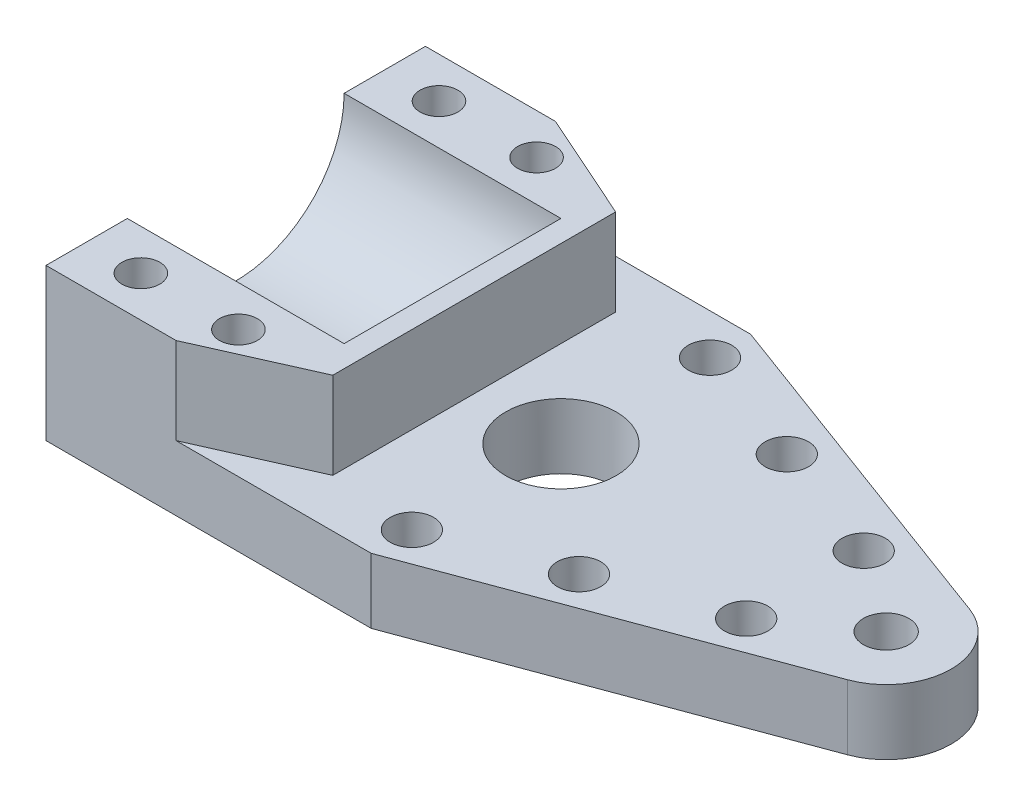
from build123d import *
from OCP.BRepFilletAPI import BRepFilletAPI_MakeChamfer

# Parameters (mm, degrees)
BOSS_EXTRUDE1_DEPTH      = 14
BOSS_EXTRUDE1_DEPTH_BACK = 14
SKETCH1_R                = 5.1
SKETCH1_R_2              = 2.1
SKETCH2_R                = 10
CUT_EXTRUDE1_DEPTH       = 20
CUT_EXTRUDE2_DEPTH       = 98
SKETCH4_R                = 2
SKETCH4_R_2              = 1.75
CUT_EXTRUDE3_DEPTH       = 98
CUT_EXTRUDE4_DEPTH       = 8
CHAMFER2_SIZE            = 10
CHAMFER2_SIZE2           = 4.452286853
SKETCH6_R                = 3.25
CUT_EXTRUDE5_DEPTH       = 1.5
SKETCH7_R                = 4.25
CUT_EXTRUDE6_DEPTH       = 1.5


with BuildPart() as part:
    # Sketch1 → Boss-Extrude1 (new, two sides: drawn at the far end of the back side and taken through both)
    with BuildSketch(Plane(origin=(0, 0, 0), x_dir=(1, 0, 0), z_dir=(0, 1, 0)).offset(-BOSS_EXTRUDE1_DEPTH_BACK)):
        with BuildLine():
            Line((-30, 17.5), (-30, -17.5))
            Line((-30, -17.5), (0, -17.5))
            Line((0, -17.5), (32.082434223, -5.627030097))
            ThreePointArc((32.082434223, -5.627030097), (36, 0), (32.082434223, 5.627030097))
            Line((32.082434223, 5.627030097), (0, 17.5))
            Line((0, 17.5), (-30, 17.5))
        make_face()
        Circle(SKETCH1_R, mode=Mode.SUBTRACT)
        with Locations((30, 0)):
            Circle(SKETCH1_R_2, mode=Mode.SUBTRACT)
    extrude(amount=BOSS_EXTRUDE1_DEPTH + BOSS_EXTRUDE1_DEPTH_BACK)

    # Sketch2 → Cut-Extrude1 (cut)
    with BuildSketch(Plane.ZY.offset(30)):
        Circle(SKETCH2_R)
    extrude(amount=-CUT_EXTRUDE1_DEPTH, mode=Mode.SUBTRACT)

    # Sketch3 → Cut-Extrude2 (cut)
    with BuildSketch(Plane.ZY.offset(30)):
        Polygon((-28.780571792, 0), (30.767977005, 0), (25.762660172, 25.983482973), (-26.204305774, 26.645951377), align=None)
    extrude(amount=-CUT_EXTRUDE2_DEPTH, mode=Mode.SUBTRACT)

    # Sketch4 → Cut-Extrude3 (cut)
    with BuildSketch(Plane(origin=(0, 0, 0), x_dir=(1, 0, 0), z_dir=(0, 1, 0))):
        with Locations((0, 13.75)):
            Circle(SKETCH4_R)
        with Locations((-25, 13.75)):
            Circle(SKETCH4_R_2)
        with Locations((-16, 13.75)):
            Circle(SKETCH4_R_2)
        with Locations((-16, -13.75)):
            Circle(SKETCH4_R_2)
        with Locations((-25, -13.75)):
            Circle(SKETCH4_R_2)
        with Locations((11.254060193, 9.585131554)):
            Circle(SKETCH4_R)
        with Locations((22.508120386, 5.420263108)):
            Circle(SKETCH4_R)
        with Locations((22.508120386, -5.420263108)):
            Circle(SKETCH4_R)
        with Locations((11.254060193, -9.585131554)):
            Circle(SKETCH4_R)
        with Locations((0, -13.75)):
            Circle(SKETCH4_R)
    extrude(amount=-CUT_EXTRUDE3_DEPTH, mode=Mode.SUBTRACT)

    # Sketch5 → Cut-Extrude4 (cut)
    with BuildSketch(Plane(origin=(0, 0, 0), x_dir=(1, 0, 0), z_dir=(0, 1, 0))):
        Polygon((-8, 24.0496753), (-8, -23.963165676), (49.955299995, -27.912565933), (56.964446833, 12.889933884), align=None)
    extrude(amount=-CUT_EXTRUDE4_DEPTH, mode=Mode.SUBTRACT)

    # Chamfer2: one chamfer whose edges measure the first distance from different faces: ONE call of the kernel's chamfer builder (chamfer() names one face for all edges)
    chamfer2_edges_1 = [part.edges().sort_by_distance(p)[0] for p in [
        (-8, -4, 17.5),
    ]]
    chamfer2_side_1 = [part.faces().sort_by_distance(p)[0] for p in [
        (-16.97752809, -7.539325843, 17.5),
    ]]
    chamfer2_edges_2 = [part.edges().sort_by_distance(p)[0] for p in [
        (-8, -4, -17.5),
    ]]
    chamfer2_side_2 = [part.faces().sort_by_distance(p)[0] for p in [
        (-16.97752809, -7.539325843, -17.5),
    ]]
    chamfer2 = BRepFilletAPI_MakeChamfer(part.part.solid().wrapped)
    for e in chamfer2_edges_1:
        chamfer2.Add(CHAMFER2_SIZE, CHAMFER2_SIZE2, e.wrapped, chamfer2_side_1[0].wrapped)  # the first distance lies on this face
    for e in chamfer2_edges_2:
        chamfer2.Add(CHAMFER2_SIZE, CHAMFER2_SIZE2, e.wrapped, chamfer2_side_2[0].wrapped)  # the first distance lies on this face
    add(Compound.cast(chamfer2.Shape()), mode=Mode.REPLACE)

    # Sketch6 → Cut-Extrude5 (cut)
    with BuildSketch(Plane.XZ.offset(14)):
        with Locations((-25, 13.75)):
            Circle(SKETCH6_R)
        with Locations((-16, 13.75)):
            Circle(SKETCH6_R)
        with Locations((-25, -13.75)):
            Circle(SKETCH6_R)
        with Locations((-16, -13.75)):
            Circle(SKETCH6_R)
    extrude(amount=-CUT_EXTRUDE5_DEPTH, mode=Mode.SUBTRACT)

    # Sketch7 → Cut-Extrude6 (cut)
    with BuildSketch(Plane.XZ.offset(14)):
        with Locations((30, 0)):
            Circle(SKETCH7_R)
    extrude(amount=-CUT_EXTRUDE6_DEPTH, mode=Mode.SUBTRACT)


solid = part.part
